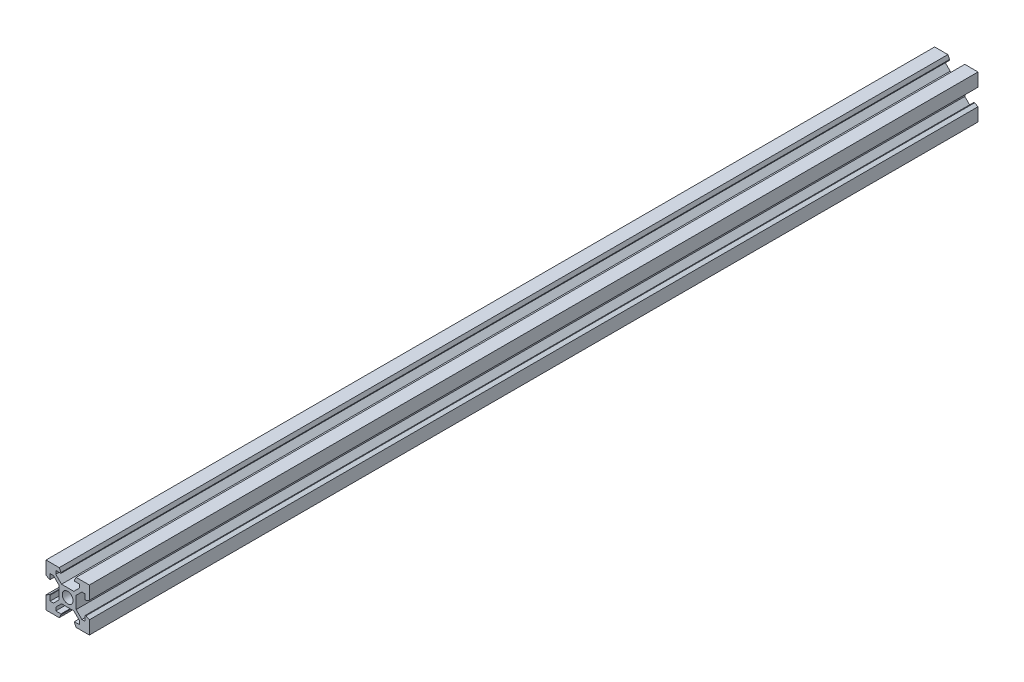
from build123d import *

# Parameters (mm, degrees)
SKETCH1_R           = 2.5
BOSS_EXTRUDE1_DEPTH = 410


with BuildPart() as part:
    # Sketch1 → Boss-Extrude1 (new body)
    with BuildSketch(Plane.XY):
        Polygon((6.1, 20), (0, 20), (0, 13.895792909), (1.56, 13.1), (1.9, 13.1), (1.9, 15.5), (3.439339828, 15.5), (6.1, 12.839339828), (6.1, 7.160660172), (3.439339828, 4.5), (1.9, 4.5), (1.9, 6.9), (1.56, 6.9), (0, 6.104207091), (0, 0), (6.1, 0), (6.9, 1.56), (6.9, 1.9), (4.5, 1.9), (4.5, 3.439339828), (7.160660172, 6.1), (12.839339828, 6.1), (15.5, 3.439339828), (15.5, 1.9), (13.1, 1.9), (13.1, 1.56), (13.9, 0), (20, 0), (20, 6.104207091), (18.44, 6.9), (18.1, 6.9), (18.1, 4.5), (16.560660172, 4.5), (13.9, 7.160660172), (13.9, 12.839339828), (16.560660172, 15.5), (18.1, 15.5), (18.1, 13.1), (18.44, 13.1), (20, 13.895792909), (20, 20), (13.9, 20), (13.1, 18.44), (13.1, 18.1), (15.5, 18.1), (15.5, 16.560660172), (12.839339828, 13.9), (7.160660172, 13.9), (4.5, 16.560660172), (4.5, 18.1), (6.9, 18.1), (6.9, 18.44), align=None)
        with Locations(Location((10, 10, 0), (0, 0, 180))):
            Circle(SKETCH1_R, mode=Mode.SUBTRACT)
    extrude(amount=BOSS_EXTRUDE1_DEPTH)


solid = part.part
